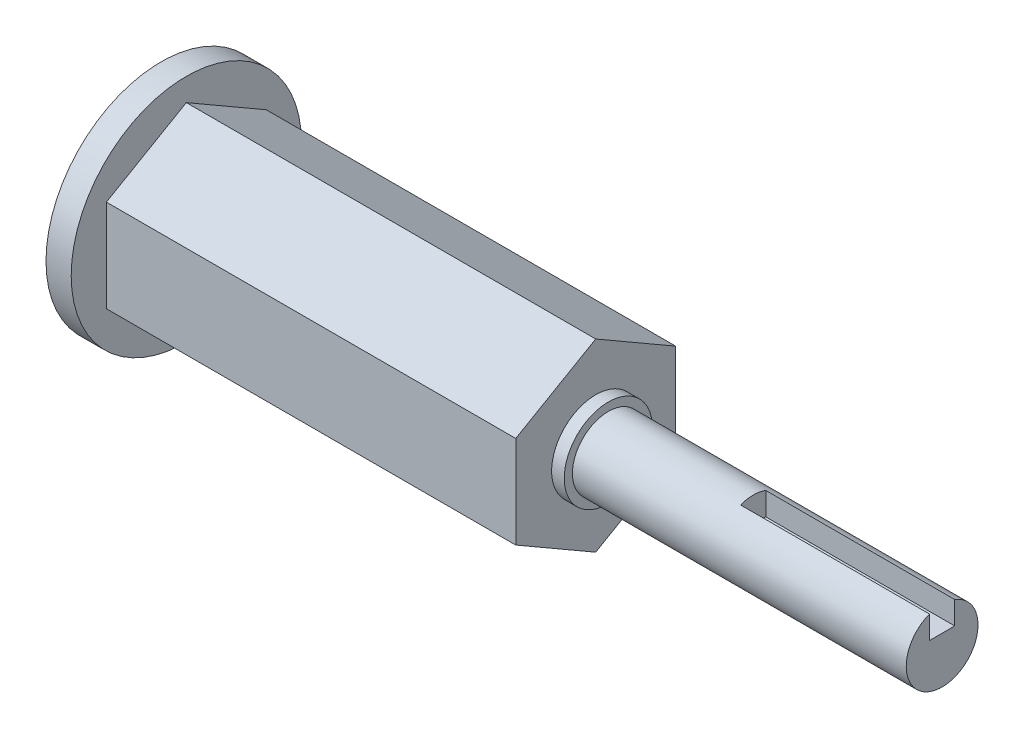
from build123d import *

# Parameters (mm, degrees)
SKETCH1_R           = 2.85
BOSS_EXTRUDE1_DEPTH = 60
SKETCH2_R           = 9.141
BOSS_EXTRUDE2_DEPTH = 2
BOSS_EXTRUDE3_DEPTH = 32.5
SKETCH4_W           = 2
SKETCH4_H           = 2
CUT_EXTRUDE1_DEPTH  = 15
SKETCH5_R           = 3.5
BOSS_EXTRUDE5_DEPTH = 1


with BuildPart() as part:
    # Sketch1 → Boss-Extrude1 (new body)
    with BuildSketch(Plane.YZ):
        with Locations(Location((0, 0, 0), (0, 0, 270))):
            Circle(SKETCH1_R)
    extrude(amount=BOSS_EXTRUDE1_DEPTH)

    # Sketch2 → Boss-Extrude2 (add)
    with BuildSketch(Plane(origin=(0, 0, 0), x_dir=(0, -1, 0), z_dir=(-1, 0, 0))):
        with Locations(Location((0, 0, 0), (0, 0, 90))):
            Circle(SKETCH2_R)
    extrude(amount=BOSS_EXTRUDE2_DEPTH)

    # Sketch3 → Boss-Extrude3 (add)
    with BuildSketch(Plane.YZ):
        Polygon((3.665, 6.34796621), (-3.665, 6.34796621), (-7.33, 0), (-3.665, -6.34796621), (3.665, -6.34796621), (7.33, 0), align=None)
    extrude(amount=BOSS_EXTRUDE3_DEPTH)

    # Sketch4 → Cut-Extrude1 (cut)
    with BuildSketch(Plane.YZ.offset(60)):
        with Locations((1.85, 0)):
            Rectangle(SKETCH4_W, SKETCH4_H)
    extrude(amount=-CUT_EXTRUDE1_DEPTH, mode=Mode.SUBTRACT)

    # Sketch5 → Boss-Extrude5 (add)
    with BuildSketch(Plane.YZ.offset(32.5)):
        with Locations(Location((0, 0, 0), (0, 0, 270))):
            Circle(SKETCH5_R)
    extrude(amount=BOSS_EXTRUDE5_DEPTH)


solid = part.part
